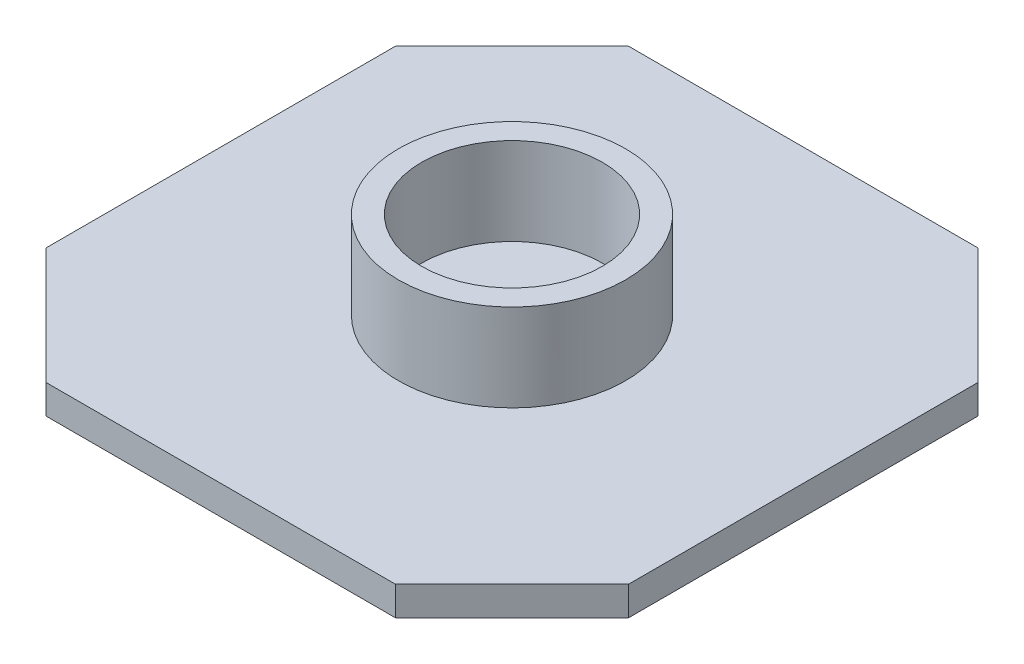
from build123d import *

# Parameters (mm, degrees)
SKIZZE1_W                       = 20
SKIZZE1_H                       = 20
AUFSATZ_LINEAR_AUSTRAGEN1_DEPTH = 1
SKIZZE2_R                       = 3.9
SKIZZE2_R_2                     = 3.1
AUFSATZ_LINEAR_AUSTRAGEN2_DEPTH = 3
FASE1_SIZE                      = 4


with BuildPart() as part:
    # Skizze1 → Aufsatz-Linear austragen1 (new body)
    with BuildSketch(Plane(origin=(0, 0, 0), x_dir=(1, 0, 0), z_dir=(0, 1, 0))):
        Rectangle(SKIZZE1_W, SKIZZE1_H)
    extrude(amount=AUFSATZ_LINEAR_AUSTRAGEN1_DEPTH)

    # Skizze2 → Aufsatz-Linear austragen2 (add)
    with BuildSketch(Plane(origin=(0, 1, 0), x_dir=(1, 0, 0), z_dir=(0, 1, 0))):
        with Locations(Location((0, 0, 0), (0, 0, 90))):
            Circle(SKIZZE2_R)
        with Locations(Location((0, 0, 0), (0, 0, 270))):
            Circle(SKIZZE2_R_2, mode=Mode.SUBTRACT)
    extrude(amount=AUFSATZ_LINEAR_AUSTRAGEN2_DEPTH)

    # Fase1
    fase1_edges = [part.edges().sort_by_distance(p)[0] for p in [
        (10, 0.5, 10),
        (-10, 0.5, 10),
        (-10, 0.5, -10),
        (10, 0.5, -10),
    ]]
    chamfer(fase1_edges, length=FASE1_SIZE)


solid = part.part
